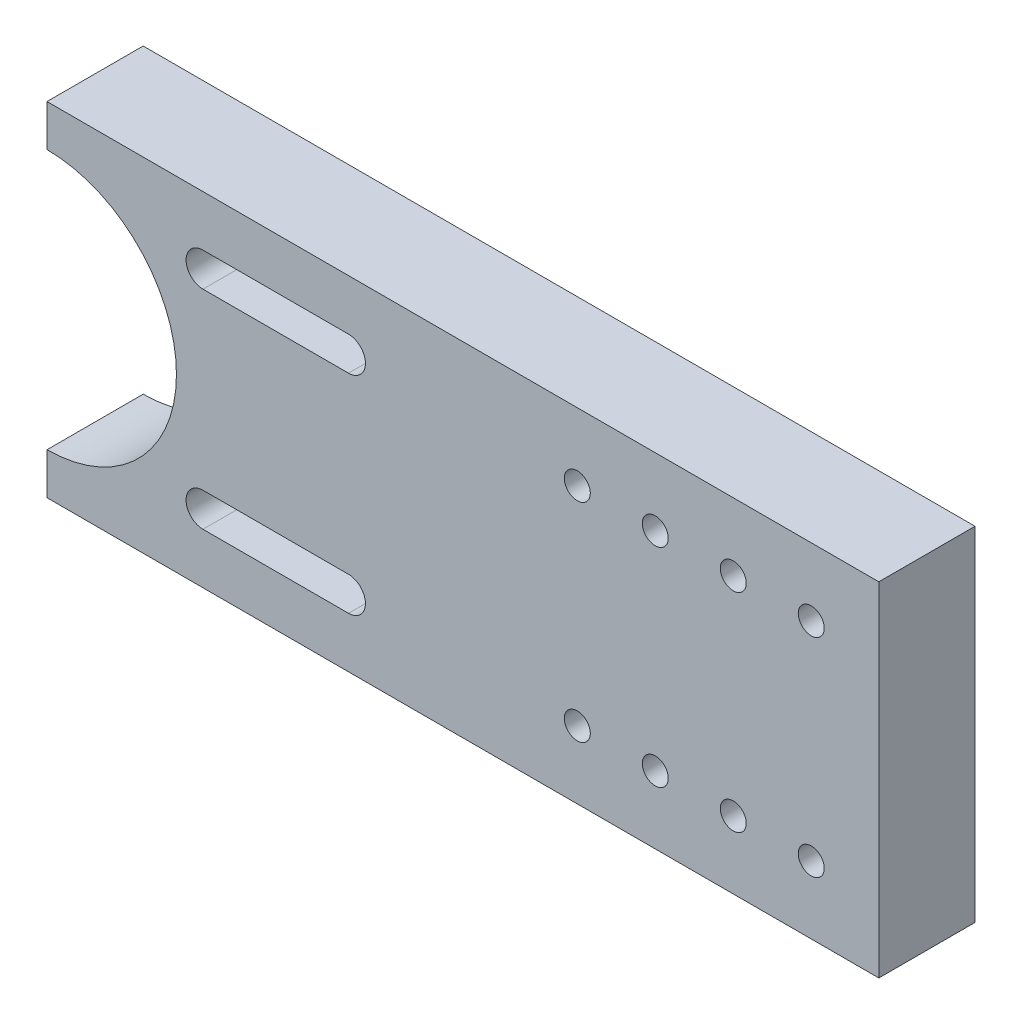
from build123d import *

# Parameters (mm, degrees)
SKETCH_1_W             = 160
SKETCH_1_H             = 66
EXTRUDE_1_DEPTH        = 18.5
SKETCH_2_R             = 25
CUT_EXTRUDE_1_DEPTH    = 20
HOLE_WIZARD_M6_1_D     = 5
PATTERN_LINEAR_1_COUNT = 4
PATTERN_LINEAR_1_PITCH = 15
CUT_EXTRUDE_4_DEPTH    = 40
HOLE_WIZARD_M4_1_D     = 3.3
HOLE_WIZARD_M4_1_DEPTH = 10.1
HOLE_WIZARD_M4_1_TIP   = 0.991420021


with BuildPart() as part:
    # 草图1 → 凸台-拉伸1 (new body)
    with BuildSketch(Plane.XY):
        with Locations((80, 33)):
            Rectangle(SKETCH_1_W, SKETCH_1_H)
    extrude(amount=EXTRUDE_1_DEPTH)

    # 草图2 → 切除-拉伸1 (cut)
    with BuildSketch(Plane.XY.offset(18.5)):
        with Locations((-0.1, 33)):
            Circle(SKETCH_2_R)
    extrude(amount=-CUT_EXTRUDE_1_DEPTH, mode=Mode.SUBTRACT)

    # M6 螺纹孔1 (through all)
    with Locations(Plane(origin=(0, 0, 0), x_dir=(-1, 0, 0), z_dir=(0, 0, -1))):
        with Locations((-147, 53), (-147, 13)):
            hole_wizard_m6_1 = Hole(HOLE_WIZARD_M6_1_D / 2)

    # 阵列(线性)1: M6 螺纹孔1 ×4
    with Locations(*[(-i * PATTERN_LINEAR_1_PITCH, 0, 0) for i in range(1, PATTERN_LINEAR_1_COUNT)]):
        add(hole_wizard_m6_1, mode=Mode.SUBTRACT)

    # 草图7 → 切除-拉伸4 (cut)
    with BuildSketch(Plane(origin=(0, 0, 0), x_dir=(-1, 0, 0), z_dir=(0, 0, -1))):
        with BuildLine():
            Line((-30, 49.75), (-58, 49.75))
            ThreePointArc((-58, 49.75), (-61.25, 53), (-58, 56.25))
            Line((-58, 56.25), (-30, 56.25))
            ThreePointArc((-30, 56.25), (-26.75, 53), (-30, 49.75))
        make_face()
        with BuildLine():
            Line((-30, 16.25), (-58, 16.25))
            ThreePointArc((-58, 16.25), (-61.25, 13), (-58, 9.75))
            Line((-58, 9.75), (-30, 9.75))
            ThreePointArc((-30, 9.75), (-26.75, 13), (-30, 16.25))
        make_face()
    extrude(amount=-CUT_EXTRUDE_4_DEPTH, mode=Mode.SUBTRACT)

    # M4 螺纹孔1
    with Locations(Plane.ZY):
        with Locations((4.75, 5), (13.75, 5), (4.75, 61), (13.75, 61)):
            Hole(HOLE_WIZARD_M4_1_D / 2, depth=HOLE_WIZARD_M4_1_DEPTH)
            with Locations((0, 0, -(HOLE_WIZARD_M4_1_DEPTH + HOLE_WIZARD_M4_1_TIP / 2))):  # 118° drill point
                Cone(0, HOLE_WIZARD_M4_1_D / 2, HOLE_WIZARD_M4_1_TIP, mode=Mode.SUBTRACT)


solid = part.part
